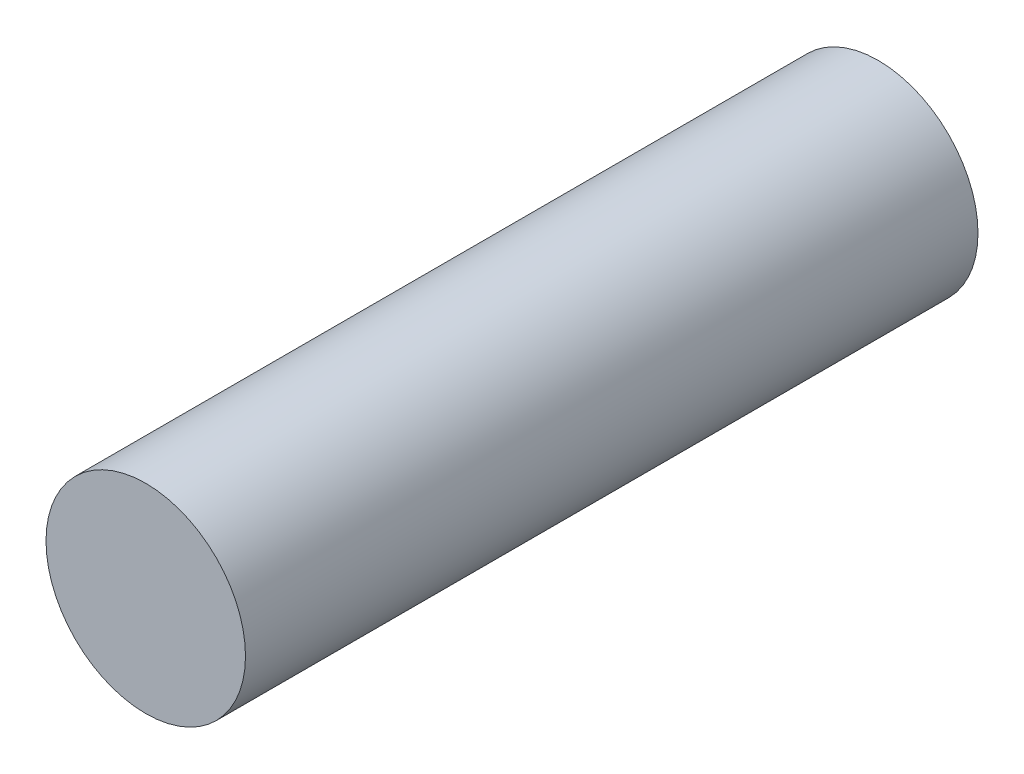
from build123d import *

# Parameters (mm, degrees)
SKETCH1_R           = 3.2
BOSS_EXTRUDE1_DEPTH = 23.5
SCALE_1_SCALE       = 2


with BuildPart() as part:
    # Sketch1 → Boss-Extrude1 (new body)
    with BuildSketch(Plane.XY):
        Circle(SKETCH1_R)
    extrude(amount=BOSS_EXTRUDE1_DEPTH)


with BuildPart() as part_1:
    # 缩放比例1: scaled about (0, 0, 11.75)
    add(part.part.scale(SCALE_1_SCALE).moved(Location((0, 0, -11.75))))


solid = part_1.part
